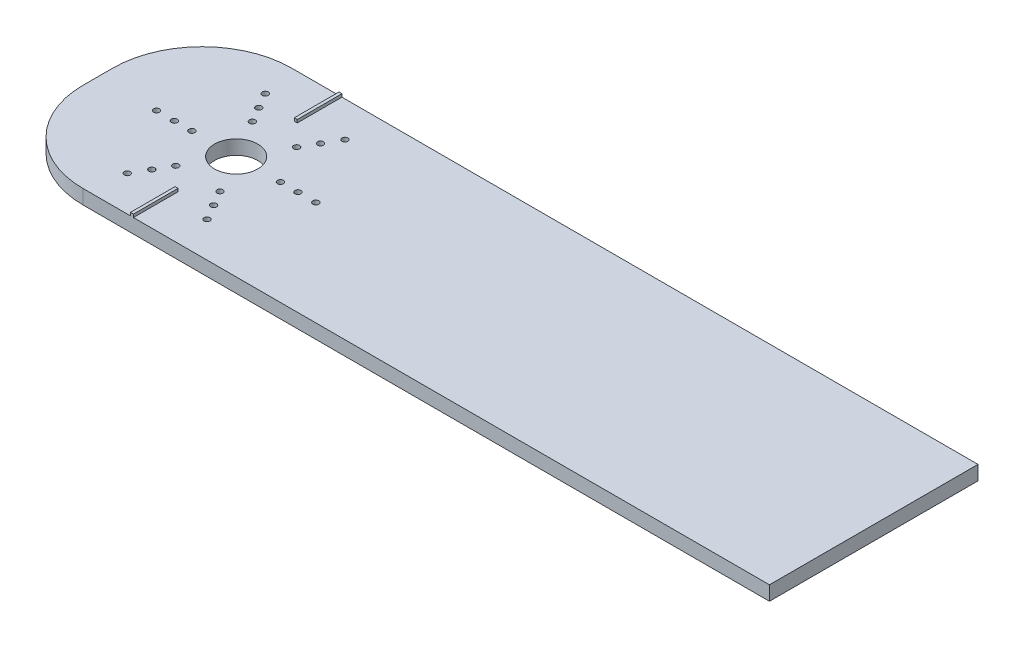
from build123d import *

# Parameters (mm, degrees)
SKETCH1_W           = 130.2
SKETCH1_H           = 35
BOSS_EXTRUDE1_DEPTH = 2.4
SKETCH2_R           = 0.5
SKETCH2_R_2         = 3.625
CUT_EXTRUDE1_DEPTH  = 2.4
SKETCH6_W           = 0.5
SKETCH6_H           = 7.5
BOSS_EXTRUDE3_DEPTH = 0.5
FILLET3_R           = 15


with BuildPart() as part:
    # Sketch1 → Boss-Extrude1 (new body)
    with BuildSketch(Plane(origin=(0, 0, 0), x_dir=(1, 0, 0), z_dir=(0, 1, 0))):
        with Locations((62.422946176, 21.495750708)):
            Rectangle(SKETCH1_W, SKETCH1_H)
    extrude(amount=BOSS_EXTRUDE1_DEPTH)

    # Sketch2 → Cut-Extrude1 (cut)
    with BuildSketch(Plane(origin=(0, 2.4, 0), x_dir=(1, 0, 0), z_dir=(0, 1, 0))):
        with Locations(Location((16.807946176, 27.930319458, 0), (0, 0, 270))):
            Circle(SKETCH2_R)
        with Locations(Location((15.340446176, 30.472104018, 0), (0, 0, 270))):
            Circle(SKETCH2_R)
        with Locations(Location((13.837946176, 33.074510357, 0), (0, 0, 270))):
            Circle(SKETCH2_R)
        with Locations(Location((24.237946176, 27.930319458, 0), (0, 0, 270))):
            Circle(SKETCH2_R)
        with Locations(Location((20.522946176, 21.495750708, 0), (0, 0, 270))):
            Circle(SKETCH2_R_2)
        with Locations(Location((13.092946176, 21.495750708, 0), (0, 0, 270))):
            Circle(SKETCH2_R)
        with Locations(Location((10.157946176, 21.495750708, 0), (0, 0, 270))):
            Circle(SKETCH2_R)
        with Locations(Location((7.152946176, 21.495750708, 0), (0, 0, 270))):
            Circle(SKETCH2_R)
        with Locations(Location((25.705446176, 30.472104018, 0), (0, 0, 270))):
            Circle(SKETCH2_R)
        with Locations(Location((27.207946176, 33.074510357, 0), (0, 0, 270))):
            Circle(SKETCH2_R)
        with Locations(Location((27.952946176, 21.495750708, 0), (0, 0, 270))):
            Circle(SKETCH2_R)
        with Locations(Location((30.887946176, 21.495750708, 0), (0, 0, 270))):
            Circle(SKETCH2_R)
        with Locations(Location((33.892946176, 21.495750708, 0), (0, 0, 270))):
            Circle(SKETCH2_R)
        with Locations(Location((24.237946176, 15.061181958, 0), (0, 0, 270))):
            Circle(SKETCH2_R)
        with Locations(Location((25.705446176, 12.519397398, 0), (0, 0, 270))):
            Circle(SKETCH2_R)
        with Locations(Location((27.207946176, 9.91699106, 0), (0, 0, 270))):
            Circle(SKETCH2_R)
        with Locations(Location((16.807946176, 15.061181958, 0), (0, 0, 270))):
            Circle(SKETCH2_R)
        with Locations(Location((15.340446176, 12.519397398, 0), (0, 0, 270))):
            Circle(SKETCH2_R)
        with Locations(Location((13.837946176, 9.91699106, 0), (0, 0, 270))):
            Circle(SKETCH2_R)
    extrude(amount=-CUT_EXTRUDE1_DEPTH, mode=Mode.SUBTRACT)

    # Sketch6 → Boss-Extrude3 (add)
    with BuildSketch(Plane(origin=(0, 2.4, 0), x_dir=(1, 0, 0), z_dir=(0, 1, 0))):
        with Locations((20.522946176, 7.745750708)):
            Rectangle(SKETCH6_W, SKETCH6_H)
        with Locations((20.522946176, 35.245750708)):
            Rectangle(SKETCH6_W, SKETCH6_H)
    extrude(amount=BOSS_EXTRUDE3_DEPTH)

    # Fillet3
    fillet3_edges = [part.edges().sort_by_distance(p)[0] for p in [
        (-2.677053824, 1.2, -38.995750708),
        (-2.677053824, 1.2, -3.995750708),
    ]]
    fillet(fillet3_edges, radius=FILLET3_R)


solid = part.part
